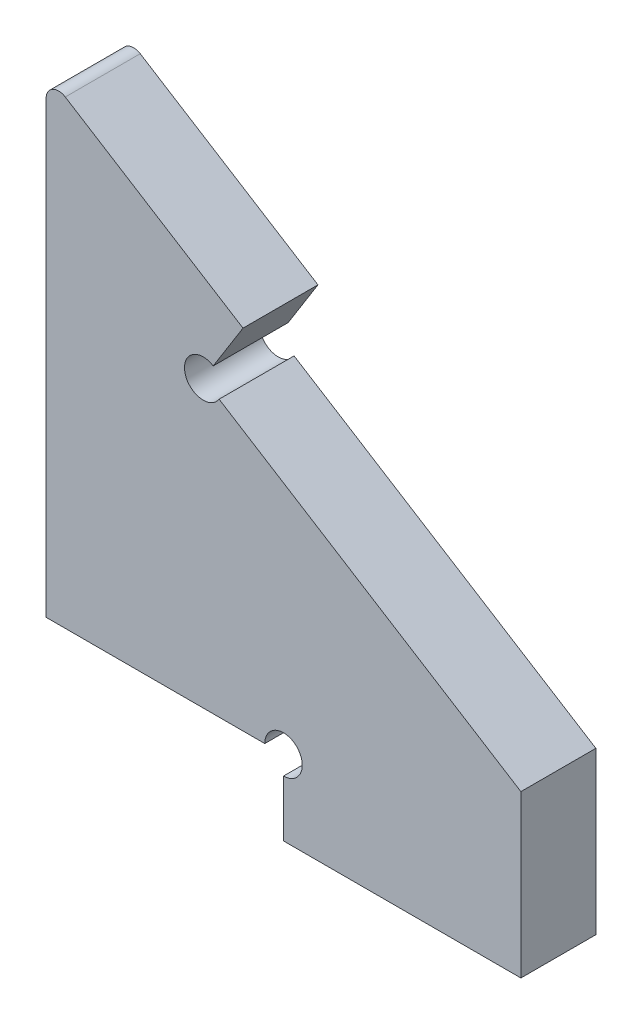
from build123d import *

# Parameters (mm, degrees)
BOSS_EXTRUDE1_START     = -31
SKETCH1_W               = 19
SKETCH1_H               = 6
BOSS_EXTRUDE1_DEPTH     = 6
BOSS_EXTRUDE2_REACH     = 726.688
SKETCH2_W               = 38
SKETCH2_H               = 6
SKETCH3_R               = 1.5
CUT_EXTRUDE1_DEPTH      = 744.440196757
FILLET1_R               = 1
CUT_EXTRUDE3_DEPTH      = 744.257611618
CUT_EXTRUDE3_DEPTH_BACK = 744.257611618
SKETCH5_R               = 1.5
CUT_EXTRUDE4_DEPTH      = 744.257611618


with BuildPart() as part:
    # Sketch1 → Boss-Extrude1 (new body)
    with BuildSketch(Plane.XY.offset(BOSS_EXTRUDE1_START)):
        with Locations((714.5, 128)):
            Rectangle(SKETCH1_W, SKETCH1_H)
    extrude(amount=BOSS_EXTRUDE1_DEPTH)

    # Boss-Extrude2: up to this plane
    boss_extrude2_end = Plane(origin=(203.909377292, 470.655270204, 323.5), z_dir=(-0.5307002791731883, -0.8475595635030614, 0))
    # Sketch2 → Boss-Extrude2 (add, up to the surface)
    with BuildSketch(Plane(origin=(0, 131, 0), x_dir=(1, 0, 0), z_dir=(0, 1, 0)), mode=Mode.PRIVATE) as boss_extrude2_sk1:
        with Locations((705, 28)):
            Rectangle(SKETCH2_W, SKETCH2_H)
    boss_extrude2_tool1 = split(extrude(boss_extrude2_sk1.sketch, amount=BOSS_EXTRUDE2_REACH, mode=Mode.PRIVATE), bisect_by=boss_extrude2_end, keep=Keep.BOTH, mode=Mode.PRIVATE)
    add(boss_extrude2_tool1.solids().sort_by_distance((705, 131, -28))[0])

    # Sketch3 → Cut-Extrude1 (cut, through all)
    with BuildSketch(Plane.XY.offset(-25)):
        with Locations((705, 131)):
            Circle(SKETCH3_R)
    extrude(amount=-CUT_EXTRUDE1_DEPTH, mode=Mode.SUBTRACT)

    # Fillet1
    fillet1_edges = [part.edges().sort_by_distance(p)[0] for p in [
        (686, 168.79373849, -28),
    ]]
    fillet(fillet1_edges, radius=FILLET1_R)

    # Sketch4 → Cut-Extrude3 (cut, two sides: drawn at the far end of the back side and taken through both)
    with BuildSketch(Plane.XY.offset(-25).offset(-CUT_EXTRUDE3_DEPTH_BACK)):
        Polygon((701.75741477, 158.927217271), (698.573213095, 153.84185989), (724, 137.920851515), (727.184201675, 143.006208896), align=None)
    extrude(amount=CUT_EXTRUDE3_DEPTH + CUT_EXTRUDE3_DEPTH_BACK, mode=Mode.SUBTRACT)

    # Sketch5 → Cut-Extrude4 (cut, through all)
    with BuildSketch(Plane.XY.offset(-25)):
        with Locations((698.573213095, 153.84185989)):
            Circle(SKETCH5_R)
    extrude(amount=-CUT_EXTRUDE4_DEPTH, mode=Mode.SUBTRACT)


solid = part.part
